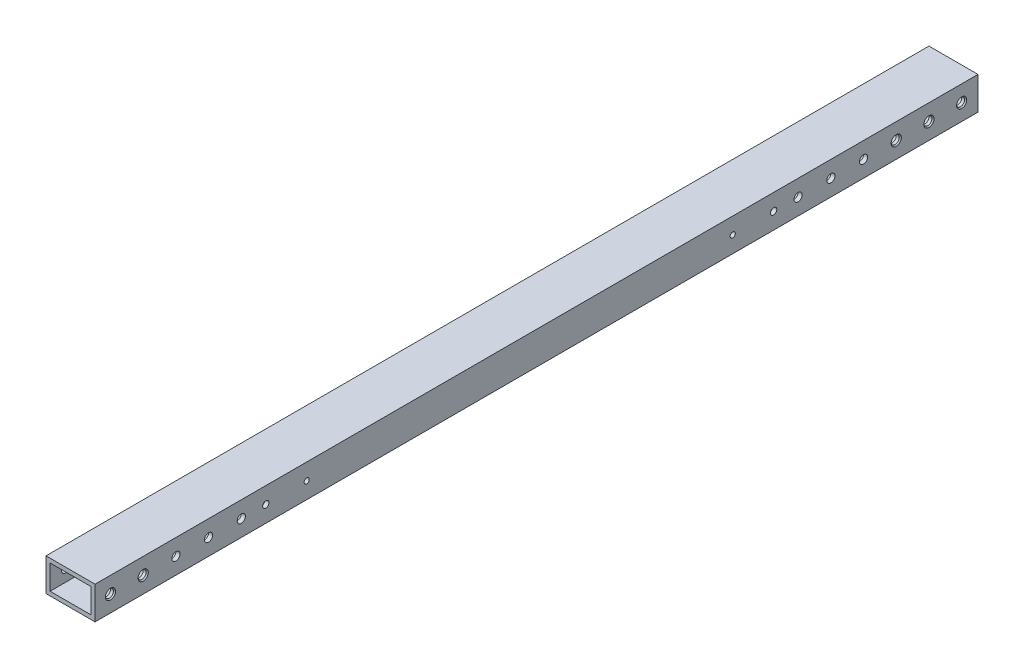
from build123d import *

# Parameters (mm, degrees)
BOSS_EXTRUDE1_DEPTH                  = 342.9
BOSS_EXTRUDE1_DEPTH_BACK             = 342.9
SKETCH3_W                            = 38.1
SKETCH3_H                            = 25.4
SKETCH3_W_2                          = 31.75
SKETCH3_H_2                          = 19.05
F_1_4_0_25_DIAMETER_HOLE2_AT_2_COUNT = 2
F_1_4_0_25_DIAMETER_HOLE2_AT_2_PITCH = 25.4
F_1_4_0_25_DIAMETER_HOLE2_AT_3_COUNT = 2
F_1_4_0_25_DIAMETER_HOLE2_AT_3_PITCH = 661.111799988
F_1_4_0_25_DIAMETER_HOLE2_AT_4_COUNT = 2
F_1_4_0_25_DIAMETER_HOLE2_AT_4_PITCH = 50.8
F_1_4_0_25_DIAMETER_HOLE2_AT_5_COUNT = 2
F_1_4_0_25_DIAMETER_HOLE2_AT_5_PITCH = 635.711799988
F_1_4_0_25_DIAMETER_HOLE3_D          = 6.35
F_5_32_0_15625_DIAMETER_HOLE1_D      = 3.96875
F_10_0_1935_DIAMETER_HOLE1_D         = 4.9149


with BuildPart() as part:
    # Sketch3 → Boss-Extrude1 (new, two sides: drawn at the far end of the back side and taken through both)
    with BuildSketch(Plane.XY.offset(-BOSS_EXTRUDE1_DEPTH_BACK)):
        Rectangle(SKETCH3_W, SKETCH3_H)
        Rectangle(SKETCH3_W_2, SKETCH3_H_2, mode=Mode.SUBTRACT)
    extrude(amount=BOSS_EXTRUDE1_DEPTH + BOSS_EXTRUDE1_DEPTH_BACK)

    # Sketch8 → 1/4 (0.25) Diameter Hole2 (revolve, cut)
    with BuildSketch(Plane(origin=(-19.05, 0, -330.2), x_dir=(0, 0, 1), z_dir=(0, 1, 0))):
        Polygon((0, 0), (0, 38.1), (3.9624, 38.1), (3.175, 37.194199916), (3.175, 0), align=None)
    f_1_4_0_25_diameter_hole2 = revolve(axis=Axis((-25.4, 0, -330.2), (1, 0, 0)), mode=Mode.SUBTRACT)

    # 1/4 (0.25) Diameter Hole2 at 2: 1/4 (0.25) Diameter Hole2 ×2
    with Locations(*[(0, 0, i * F_1_4_0_25_DIAMETER_HOLE2_AT_2_PITCH) for i in range(1, F_1_4_0_25_DIAMETER_HOLE2_AT_2_COUNT)]):
        add(f_1_4_0_25_diameter_hole2, mode=Mode.SUBTRACT)

    # 1/4 (0.25) Diameter Hole2 at 3: 1/4 (0.25) Diameter Hole2 ×2
    with Locations(*[(0, 0, i * F_1_4_0_25_DIAMETER_HOLE2_AT_3_PITCH) for i in range(1, F_1_4_0_25_DIAMETER_HOLE2_AT_3_COUNT)]):
        add(f_1_4_0_25_diameter_hole2, mode=Mode.SUBTRACT)

    # 1/4 (0.25) Diameter Hole2 at 4: 1/4 (0.25) Diameter Hole2 ×2
    with Locations(*[(0, 0, i * F_1_4_0_25_DIAMETER_HOLE2_AT_4_PITCH) for i in range(1, F_1_4_0_25_DIAMETER_HOLE2_AT_4_COUNT)]):
        add(f_1_4_0_25_diameter_hole2, mode=Mode.SUBTRACT)

    # 1/4 (0.25) Diameter Hole2 at 5: 1/4 (0.25) Diameter Hole2 ×2
    with Locations(*[(0, 0, i * F_1_4_0_25_DIAMETER_HOLE2_AT_5_PITCH) for i in range(1, F_1_4_0_25_DIAMETER_HOLE2_AT_5_COUNT)]):
        add(f_1_4_0_25_diameter_hole2, mode=Mode.SUBTRACT)

    # 1/4 (0.25) Diameter Hole3 (through all)
    with Locations(Plane(origin=(19.05, 0, 0), x_dir=(0, 0, -1), z_dir=(1, 0, 0))):
        with Locations((-280.111799988, 0), (-254.711799988, 0), (-229.311799988, 0), (254, 0), (228.6, 0), (203.2, 0)):
            Hole(F_1_4_0_25_DIAMETER_HOLE3_D / 2)

    # 5/32 (0.15625) Diameter Hole1 (through all)
    with Locations(Plane(origin=(19.05, 0, 0), x_dir=(0, 0, -1), z_dir=(1, 0, 0))):
        with Locations((152.4, 0), (-178.511799988, 0)):
            Hole(F_5_32_0_15625_DIAMETER_HOLE1_D / 2)

    # #10 (0.1935) Diameter Hole1 (through all)
    with Locations(Plane.ZY.offset(19.05)):
        with Locations((-184.15, 0), (210.261799988, 0)):
            Hole(F_10_0_1935_DIAMETER_HOLE1_D / 2)


solid = part.part
